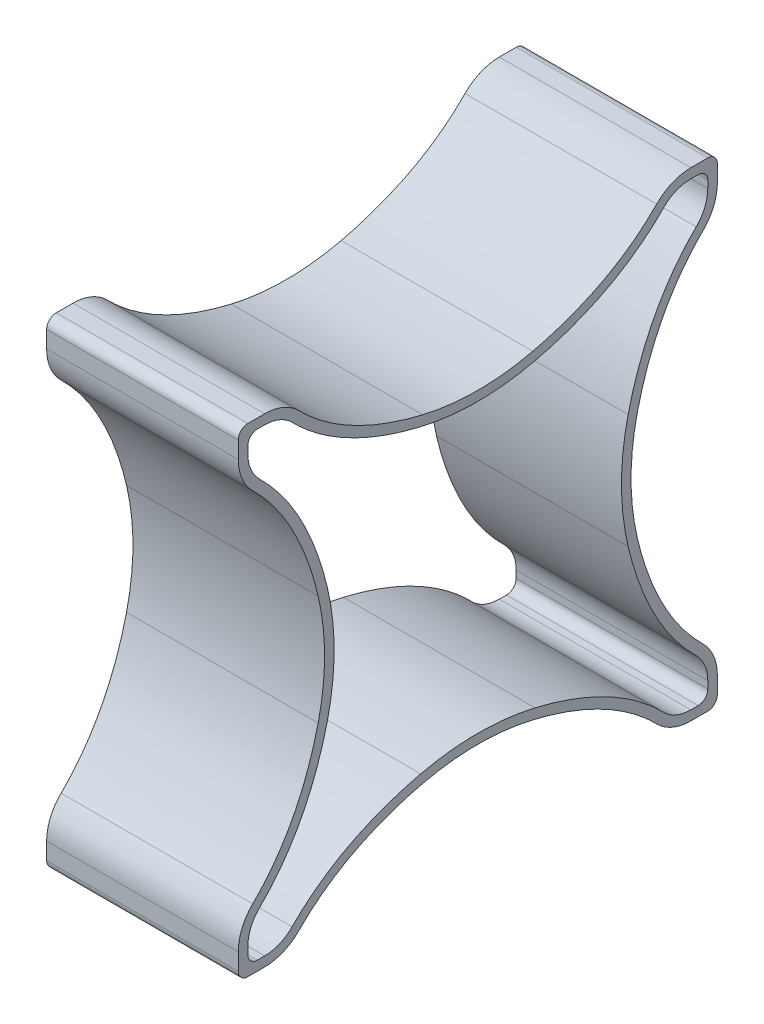
from build123d import *

# Parameters (mm, degrees)
BOSS_EXTRUDE1_DEPTH = 40
FILLET1_R           = 2


with BuildPart() as part:
    # Sketch1 → Boss-Extrude1 (new body)
    with BuildSketch(Plane(origin=(0, 0, 0), x_dir=(0, 0, -1), z_dir=(1, 0, 0))):
        with BuildLine():
            Line((100, 0), (100, -5.509803926))
            ThreePointArc((100, -5.509803926), (99.216139085, -9.390883719), (96.987443928, -12.663518161))
            add(Edge.make_bspline(
                [(96.987443928, -12.663518161), (94.284956793, -15.303192699), (88.725985213, -22.501160026), (85.001584131, -31.833431523), (83.50630434, -37.738521084), (83.320771704, -38.525392743)],
                knots=[0.087567714, 0.087567714, 0.087567714, 0.087567714, 0.336049895, 0.688961666, 0.74236025, 0.74236025, 0.74236025, 0.74236025], degree=3))
            ThreePointArc((83.320771704, -38.525392743), (81.98629737, -50), (83.320771704, -61.474607257))
            add(Edge.make_bspline(
                [(96.987443928, -87.336481839), (94.284956793, -84.696807301), (88.725985213, -77.498839974), (85.001584131, -68.166568477), (83.50630434, -62.261478916), (83.320771704, -61.474607257)],
                knots=[0.087567714, 0.087567714, 0.087567714, 0.087567714, 0.336049895, 0.688961666, 0.74236025, 0.74236025, 0.74236025, 0.74236025], degree=3))
            ThreePointArc((96.987443928, -87.336481839), (99.216139085, -90.609116281), (100, -94.490196074))
            Line((100, -94.490196074), (100, -100))
            Line((100, -100), (94.490196074, -100))
            ThreePointArc((94.490196074, -100), (90.609116281, -99.216139085), (87.336481839, -96.987443928))
            add(Edge.make_bspline(
                [(87.336481839, -96.987443928), (84.696807301, -94.284956793), (77.498839974, -88.725985213), (68.166568477, -85.001584131), (62.261478916, -83.50630434), (61.474607257, -83.320771704)],
                knots=[0.087567714, 0.087567714, 0.087567714, 0.087567714, 0.336049895, 0.688961666, 0.74236025, 0.74236025, 0.74236025, 0.74236025], degree=3))
            ThreePointArc((61.474607257, -83.320771704), (50, -81.98629737), (38.525392743, -83.320771704))
            add(Edge.make_bspline(
                [(12.663518161, -96.987443928), (15.303192699, -94.284956793), (22.501160026, -88.725985213), (31.833431523, -85.001584131), (37.738521084, -83.50630434), (38.525392743, -83.320771704)],
                knots=[0.087567714, 0.087567714, 0.087567714, 0.087567714, 0.336049895, 0.688961666, 0.74236025, 0.74236025, 0.74236025, 0.74236025], degree=3))
            ThreePointArc((12.663518161, -96.987443928), (9.390883719, -99.216139085), (5.509803926, -100))
            Line((5.509803926, -100), (0, -100))
            Line((0, -100), (0, -94.490196074))
            ThreePointArc((0, -94.490196074), (0.783860915, -90.609116281), (3.012556072, -87.336481839))
            add(Edge.make_bspline(
                [(3.012556072, -87.336481839), (5.715043207, -84.696807301), (11.274014787, -77.498839974), (14.998415869, -68.166568477), (16.49369566, -62.261478916), (16.679228296, -61.474607257)],
                knots=[0.087567714, 0.087567714, 0.087567714, 0.087567714, 0.336049895, 0.688961666, 0.74236025, 0.74236025, 0.74236025, 0.74236025], degree=3))
            ThreePointArc((16.679228296, -61.474607257), (18.01370263, -50), (16.679228296, -38.525392743))
            add(Edge.make_bspline(
                [(3.012556072, -12.663518161), (5.715043207, -15.303192699), (11.274014787, -22.501160026), (14.998415869, -31.833431523), (16.49369566, -37.738521084), (16.679228296, -38.525392743)],
                knots=[0.087567714, 0.087567714, 0.087567714, 0.087567714, 0.336049895, 0.688961666, 0.74236025, 0.74236025, 0.74236025, 0.74236025], degree=3))
            ThreePointArc((3.012556072, -12.663518161), (0.783860915, -9.390883719), (0, -5.509803926))
            Line((0, -5.509803926), (0, 0))
            Line((0, 0), (5.509803926, 0))
            ThreePointArc((5.509803926, 0), (9.390883719, -0.783860915), (12.663518161, -3.012556072))
            add(Edge.make_bspline(
                [(12.663518161, -3.012556072), (15.303192699, -5.715043207), (22.501160026, -11.274014787), (31.833431523, -14.998415869), (37.738521084, -16.49369566), (38.525392743, -16.679228296)],
                knots=[0.087567714, 0.087567714, 0.087567714, 0.087567714, 0.336049895, 0.688961666, 0.74236025, 0.74236025, 0.74236025, 0.74236025], degree=3))
            ThreePointArc((38.525392743, -16.679228296), (50, -18.01370263), (61.474607257, -16.679228296))
            add(Edge.make_bspline(
                [(87.336481839, -3.012556072), (84.696807301, -5.715043207), (77.498839974, -11.274014787), (68.166568477, -14.998415869), (62.261478916, -16.49369566), (61.474607257, -16.679228296)],
                knots=[0.087567714, 0.087567714, 0.087567714, 0.087567714, 0.336049895, 0.688961666, 0.74236025, 0.74236025, 0.74236025, 0.74236025], degree=3))
            ThreePointArc((87.336481839, -3.012556072), (90.609116281, -0.783860915), (94.490196074, 0))
            Line((94.490196074, 0), (100, 0))
        make_face()
        with BuildLine():
            Line((2, -2), (2, -5.509803926))
            ThreePointArc((2, -5.509803926), (2.627088732, -8.61466776), (4.410044858, -11.232775314))
            add(Edge.make_bspline(
                [(4.410044858, -11.232775314), (5.338828529, -12.139971717), (7.119384177, -14.045499285), (10.298925927, -18.104117855), (13.619253938, -23.620299694), (16.6302594, -30.724007948), (18.043201909, -35.595313625), (18.625849322, -38.066408453)],
                knots=[0.087567714, 0.087567714, 0.087567714, 0.087567714, 0.169416781, 0.251265848, 0.414963982, 0.578662116, 0.74236025, 0.74236025, 0.74236025, 0.74236025], degree=3))
            ThreePointArc((18.625849322, -38.066408453), (20.01370263, -50), (18.625849322, -61.933591547))
            add(Edge.make_bspline(
                [(18.625849322, -61.933591547), (18.043201909, -64.404686375), (16.6302594, -69.275992052), (13.619253938, -76.379700306), (10.298925927, -81.895882145), (7.119384178, -85.954500715), (5.338828529, -87.860028283), (4.410044858, -88.767224686)],
                knots=[0.087567714, 0.087567714, 0.087567714, 0.087567714, 0.251265848, 0.414963982, 0.578662116, 0.660511183, 0.74236025, 0.74236025, 0.74236025, 0.74236025], degree=3))
            ThreePointArc((4.410044858, -88.767224686), (2.627088732, -91.38533224), (2, -94.490196074))
            Line((2, -94.490196074), (2, -98))
            Line((2, -98), (5.509803926, -98))
            ThreePointArc((5.509803926, -98), (8.61466776, -97.372911268), (11.232775314, -95.589955142))
            add(Edge.make_bspline(
                [(11.232775314, -95.589955142), (12.139971717, -94.661171471), (14.045499285, -92.880615823), (18.104117855, -89.701074073), (23.620299694, -86.380746062), (30.724007948, -83.3697406), (35.595313625, -81.956798091), (38.066408453, -81.374150678)],
                knots=[0.087567714, 0.087567714, 0.087567714, 0.087567714, 0.169416781, 0.251265848, 0.414963982, 0.578662116, 0.74236025, 0.74236025, 0.74236025, 0.74236025], degree=3))
            ThreePointArc((38.066408453, -81.374150678), (50, -79.98629737), (61.933591547, -81.374150678))
            add(Edge.make_bspline(
                [(61.933591547, -81.374150678), (64.404686375, -81.956798091), (69.275992052, -83.3697406), (76.379700306, -86.380746062), (81.895882145, -89.701074073), (85.954500715, -92.880615823), (87.860028283, -94.661171471), (88.767224686, -95.589955142)],
                knots=[0.087567714, 0.087567714, 0.087567714, 0.087567714, 0.251265848, 0.414963982, 0.578662116, 0.660511183, 0.74236025, 0.74236025, 0.74236025, 0.74236025], degree=3))
            ThreePointArc((88.767224686, -95.589955142), (91.38533224, -97.372911268), (94.490196074, -98))
            Line((94.490196074, -98), (98, -98))
            Line((98, -98), (98, -94.490196074))
            ThreePointArc((98, -94.490196074), (97.372911268, -91.38533224), (95.589955142, -88.767224686))
            add(Edge.make_bspline(
                [(95.589955142, -88.767224686), (94.661171471, -87.860028283), (92.880615823, -85.954500715), (89.701074073, -81.895882145), (86.380746062, -76.379700306), (83.3697406, -69.275992052), (81.956798091, -64.404686375), (81.374150678, -61.933591547)],
                knots=[0.087567714, 0.087567714, 0.087567714, 0.087567714, 0.169416781, 0.251265848, 0.414963982, 0.578662116, 0.74236025, 0.74236025, 0.74236025, 0.74236025], degree=3))
            ThreePointArc((81.374150678, -61.933591547), (79.98629737, -50), (81.374150678, -38.066408453))
            add(Edge.make_bspline(
                [(81.374150678, -38.066408453), (81.956798091, -35.595313625), (83.3697406, -30.724007948), (86.380746062, -23.620299694), (89.701074073, -18.104117855), (92.880615823, -14.045499285), (94.661171471, -12.139971717), (95.589955142, -11.232775314)],
                knots=[0.087567714, 0.087567714, 0.087567714, 0.087567714, 0.251265848, 0.414963982, 0.578662116, 0.660511183, 0.74236025, 0.74236025, 0.74236025, 0.74236025], degree=3))
            ThreePointArc((95.589955142, -11.232775314), (97.372911268, -8.61466776), (98, -5.509803926))
            Line((98, -5.509803926), (98, -2))
            Line((98, -2), (94.490196074, -2))
            ThreePointArc((94.490196074, -2), (91.38533224, -2.627088732), (88.767224686, -4.410044858))
            add(Edge.make_bspline(
                [(88.767224686, -4.410044858), (87.860028283, -5.338828529), (85.954500715, -7.119384177), (81.895882145, -10.298925927), (76.379700306, -13.619253938), (69.275992052, -16.6302594), (64.404686375, -18.043201909), (61.933591547, -18.625849322)],
                knots=[0.087567714, 0.087567714, 0.087567714, 0.087567714, 0.169416781, 0.251265848, 0.414963982, 0.578662116, 0.74236025, 0.74236025, 0.74236025, 0.74236025], degree=3))
            ThreePointArc((61.933591547, -18.625849322), (50, -20.01370263), (38.066408453, -18.625849322))
            add(Edge.make_bspline(
                [(38.066408453, -18.625849322), (35.595313625, -18.043201909), (30.724007948, -16.6302594), (23.620299694, -13.619253938), (18.104117855, -10.298925927), (14.045499285, -7.119384177), (12.139971717, -5.338828529), (11.232775314, -4.410044858)],
                knots=[0.087567714, 0.087567714, 0.087567714, 0.087567714, 0.251265848, 0.414963982, 0.578662116, 0.660511183, 0.74236025, 0.74236025, 0.74236025, 0.74236025], degree=3))
            ThreePointArc((11.232775314, -4.410044858), (8.61466776, -2.627088732), (5.509803926, -2))
            Line((5.509803926, -2), (2, -2))
        make_face(mode=Mode.SUBTRACT)
    extrude(amount=BOSS_EXTRUDE1_DEPTH)

    # Fillet1
    fillet1_edges = [part.edges().sort_by_distance(p)[0] for p in [
        (20, 0, 0),
        (20, -2, -2),
        (20, -100, 0),
        (20, -98, -2),
        (20, 0, -100),
        (20, -2, -98),
        (20, -100, -100),
        (20, -98, -98),
    ]]
    fillet(fillet1_edges, radius=FILLET1_R)


solid = part.part
